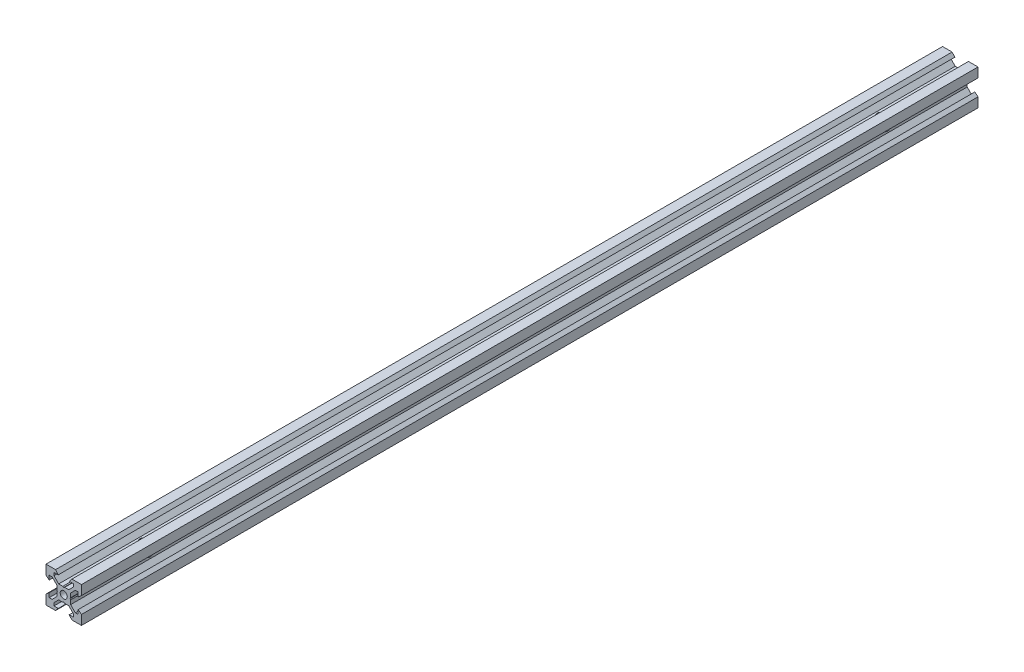
from build123d import *

# Parameters (mm, degrees)
SKETCH1_R               = 2
BOSS_EXTRUDE1_DEPTH     = 506
CUT_EXTRUDE1_DEPTH      = 507.289650299
CUT_EXTRUDE1_DEPTH_BACK = 507.289650299
SKETCH2_R               = 2
CUT_EXTRUDE2_DEPTH      = 507.289650299
CUT_EXTRUDE2_DEPTH_BACK = 507.289650299
SKETCH3_R               = 2


with BuildPart() as part:
    # Sketch1 → Boss-Extrude1 (new body)
    with BuildSketch(Plane.XY):
        Polygon((10, 10), (10, 4.610379336), (8.2, 3.1), (8.2, 5.5), (6.560660172, 5.5), (3.9, 2.839339828), (3.9, 0.519615242), (3.6, 0), (3.9, -0.519615242), (3.9, -2.839339828), (6.560660172, -5.5), (8.2, -5.5), (8.2, -3.1), (10, -4.610379336), (10, -10), (4.610379336, -10), (3.1, -8.2), (5.5, -8.2), (5.5, -6.560660172), (2.839339828, -3.9), (0.519615242, -3.9), (0, -3.6), (-0.519615242, -3.9), (-2.839339828, -3.9), (-5.5, -6.560660172), (-5.5, -8.2), (-3.1, -8.2), (-4.610379336, -10), (-10, -10), (-10, -4.610379336), (-8.2, -3.1), (-8.2, -5.5), (-6.560660172, -5.5), (-3.9, -2.839339828), (-3.9, -0.519615242), (-3.6, 0), (-3.9, 0.519615242), (-3.9, 2.839339828), (-6.560660172, 5.5), (-8.2, 5.5), (-8.2, 3.1), (-10, 4.610379336), (-10, 10), (-4.610379336, 10), (-3.1, 8.2), (-5.5, 8.2), (-5.5, 6.560660172), (-2.839339828, 3.9), (-0.519615242, 3.9), (0, 3.6), (0.519615242, 3.9), (2.839339828, 3.9), (5.5, 6.560660172), (5.5, 8.2), (3.1, 8.2), (4.610379336, 10), align=None)
        Circle(SKETCH1_R, mode=Mode.SUBTRACT)
    extrude(amount=BOSS_EXTRUDE1_DEPTH)

    # Sketch2 → Cut-Extrude1 (cut, two sides: drawn at the far end of the back side and taken through both)
    with BuildSketch(Plane(origin=(0, -3.9, 0), x_dir=(-1, 0, 0), z_dir=(0, -1, 0)).offset(-CUT_EXTRUDE1_DEPTH_BACK)):
        with Locations(Location((0, -461, 0), (0, 0, 90))):
            Circle(SKETCH2_R)
        with Locations(Location((0, -45, 0), (0, 0, 90))):
            Circle(SKETCH2_R)
    extrude(amount=CUT_EXTRUDE1_DEPTH + CUT_EXTRUDE1_DEPTH_BACK, mode=Mode.SUBTRACT)

    # Sketch3 → Cut-Extrude2 (cut, two sides: drawn at the far end of the back side and taken through both)
    with BuildSketch(Plane(origin=(3.9, 0, 0), x_dir=(0, 0, -1), z_dir=(1, 0, 0)).offset(-CUT_EXTRUDE2_DEPTH_BACK)):
        with Locations(Location((-45, 0, 0), (0, 0, 45))):
            Circle(SKETCH3_R)
        with Locations(Location((-461, 0, 0), (0, 0, 45))):
            Circle(SKETCH3_R)
    extrude(amount=CUT_EXTRUDE2_DEPTH + CUT_EXTRUDE2_DEPTH_BACK, mode=Mode.SUBTRACT)


solid = part.part
